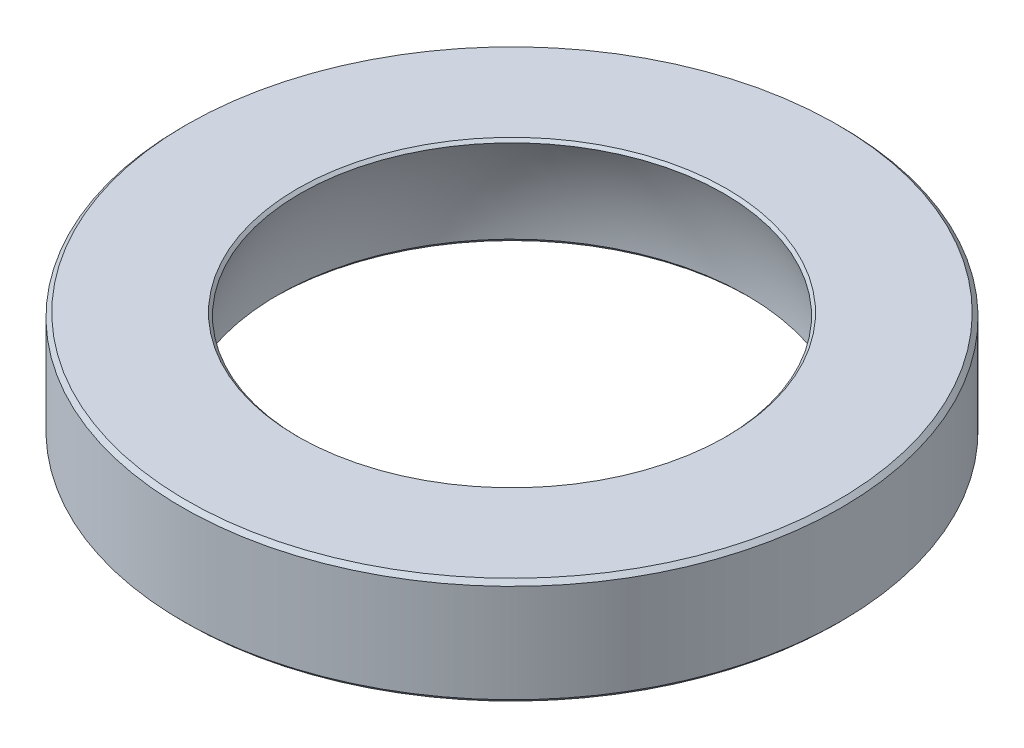
from build123d import *
from OCP.BRepFilletAPI import BRepFilletAPI_MakeChamfer

# Parameters (mm, degrees)
CUT_EXTRUDE1_DEPTH      = 18.407344018
CUT_EXTRUDE1_DEPTH_BACK = 18.407344018
SKETCH3_W               = 34.205973053
SKETCH3_H               = 8.392509863
CHAMFER1_SIZE           = 0.15
CHAMFER1_SIZE2          = 0.112518034


with BuildPart() as part:
    # Sketch2 → Revolve1 (revolve)
    with BuildSketch(Plane.XY):
        with BuildLine():
            Line((-12, -3.875), (-7.664872763, -3.875))
            ThreePointArc((-7.664872763, -3.875), (-8.541796068, 0), (-7.664872763, 3.875))
            Line((-7.664872763, 3.875), (-12, 3.875))
            Line((-12, 3.875), (-12, -3.875))
        make_face()
    revolve(axis=Axis((0, 6, 0), (0, -1, 0)))

    # Sketch3 → Cut-Extrude1 (cut, two sides: drawn at the far end of the back side and taken through both)
    with BuildSketch(Plane.XY.offset(-CUT_EXTRUDE1_DEPTH_BACK)):
        with Locations((5.102986527, -4.196254932)):
            Rectangle(SKETCH3_W, SKETCH3_H)
    extrude(amount=CUT_EXTRUDE1_DEPTH + CUT_EXTRUDE1_DEPTH_BACK, mode=Mode.SUBTRACT)

    # Chamfer1: one chamfer whose edges measure the first distance from different faces: ONE call of the kernel's chamfer builder (chamfer() names one face for all edges)
    chamfer1_edges_1 = [part.edges().sort_by_distance(p)[0] for p in [
        (12, 0, 0),
        (8.541796067, 0, 0),
        (12, 3.875, 0),
    ]]
    chamfer1_edges_2 = [part.edges().sort_by_distance(p)[0] for p in [
        (7.664872763, 3.875, 0),
    ]]
    chamfer1_side_2 = [part.faces().sort_by_distance(p)[0] for p in [
        (8.004284018, 3.875, 0),
    ]]
    chamfer1 = BRepFilletAPI_MakeChamfer(part.part.solid().wrapped)
    for e in chamfer1_edges_1:
        chamfer1.Add(CHAMFER1_SIZE, e.wrapped)
    for e in chamfer1_edges_2:
        chamfer1.Add(CHAMFER1_SIZE, CHAMFER1_SIZE2, e.wrapped, chamfer1_side_2[0].wrapped)  # the first distance lies on this face
    add(Compound.cast(chamfer1.Shape()), mode=Mode.REPLACE)


solid = part.part
